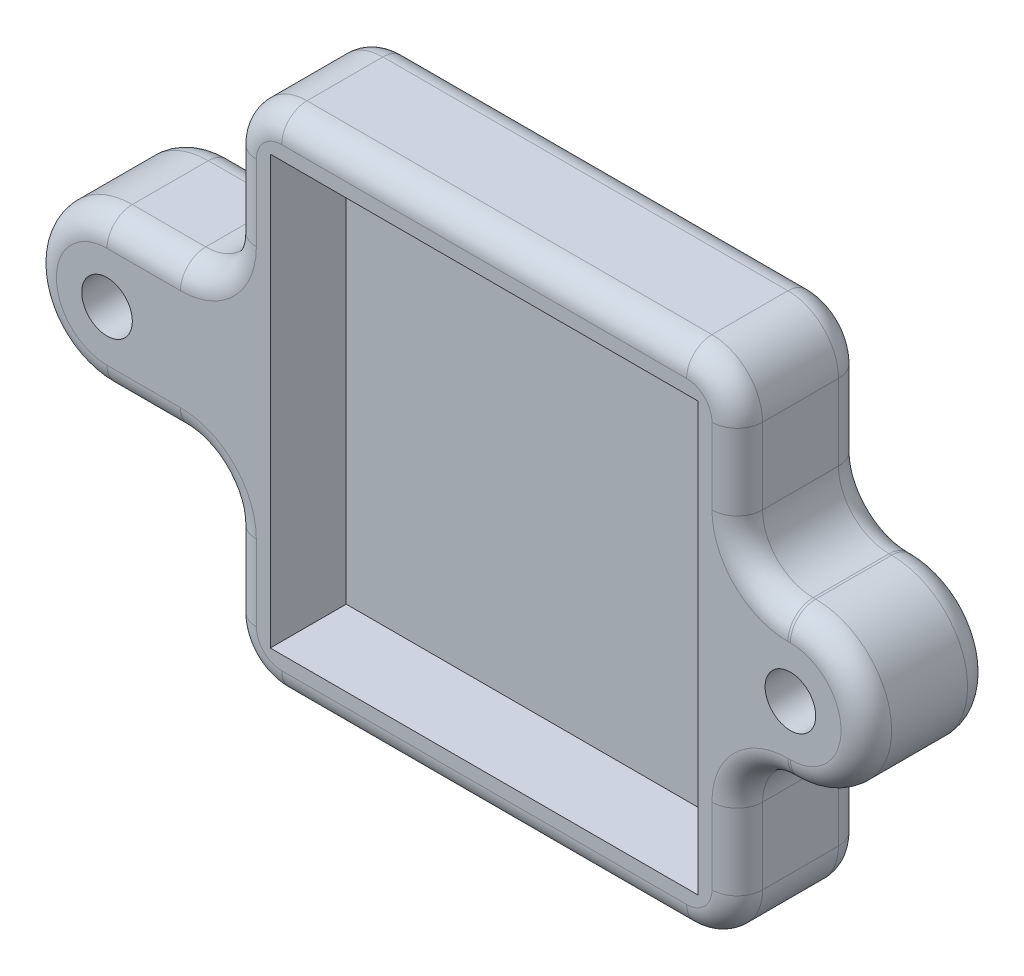
from build123d import *

# Parameters (mm, degrees)
SKETCH1_R           = 1
BOSS_EXTRUDE1_DEPTH = 5
SKETCH2_W           = 16.9
SKETCH2_H           = 16.9
CUT_EXTRUDE1_DEPTH  = 3
FILLET1_R           = 2
FILLET2_R           = 1


with BuildPart() as part:
    # Sketch1 → Boss-Extrude1 (new body)
    with BuildSketch(Plane.XY):
        with BuildLine():
            Line((-12, 3), (-7.1, 3))
            Line((-7.1, 3), (-7.1, 10))
            Line((-7.1, 10), (12.9, 10))
            Line((12.9, 10), (12.9, 3))
            Line((12.9, 3), (15, 3))
            ThreePointArc((15, 3), (18, 0), (15, -3))
            Line((15, -3), (12.9, -3))
            Line((12.9, -3), (12.9, -10))
            Line((12.9, -10), (-7.1, -10))
            Line((-7.1, -10), (-7.1, -3))
            Line((-7.1, -3), (-12, -3))
            ThreePointArc((-12, -3), (-15, 0), (-12, 3))
        make_face()
        with Locations((-12, 0)):
            Circle(SKETCH1_R, mode=Mode.SUBTRACT)
        with Locations((15, 0)):
            Circle(SKETCH1_R, mode=Mode.SUBTRACT)
    extrude(amount=BOSS_EXTRUDE1_DEPTH)

    # Sketch2 → Cut-Extrude1 (cut)
    with BuildSketch(Plane.XY.offset(5)):
        with Locations((2.9, 0)):
            Rectangle(SKETCH2_W, SKETCH2_H)
    extrude(amount=-CUT_EXTRUDE1_DEPTH, mode=Mode.SUBTRACT)

    # Fillet1
    fillet1_edges = [part.edges().sort_by_distance(p)[0] for p in [
        (-7.1, 10, 2.5),
        (12.9, 10, 2.5),
        (12.9, 3, 2.5),
        (12.9, -3, 2.5),
        (12.9, -10, 2.5),
        (-7.1, -10, 2.5),
        (-7.1, -3, 2.5),
        (-7.1, 3, 2.5),
    ]]
    fillet(fillet1_edges, radius=FILLET1_R)

    # Fillet2
    fillet2_edges = [part.edges().sort_by_distance(p)[0] for p in [
        (-15, 0, 5),
        (14.95, 3, 0),
        (18, 0, 0),
        (-10.55, -3, 5),
        (-10.55, -3, 0),
        (-15, 0, 0),
        (18, 0, 5),
        (14.95, 3, 5),
        (12.9, -6.5, 0),
        (12.9, -6.5, 5),
        (-7.1, 6.5, 0),
        (2.9, 10, 0),
        (12.9, 6.5, 0),
        (14.95, -3, 0),
        (2.9, -10, 0),
        (-7.1, -6.5, 0),
        (-10.55, 3, 0),
        (12.314213562, 9.414213562, 0),
        (-6.514213562, 9.414213562, 0),
        (-6.514213562, -9.414213562, 0),
        (12.314213562, -9.414213562, 0),
        (2.9, -10, 5),
        (-7.1, 6.5, 5),
        (-10.55, 3, 5),
        (-7.1, -6.5, 5),
        (14.95, -3, 5),
        (12.9, 6.5, 5),
        (2.9, 10, 5),
        (12.314213562, 9.414213562, 5),
        (-6.514213562, 9.414213562, 5),
        (-6.514213562, -9.414213562, 5),
        (12.314213562, -9.414213562, 5),
        (-7.685786438, -3.585786438, 0),
        (-7.685786438, -3.585786438, 5),
        (-7.685786438, 3.585786438, 0),
        (-7.685786438, 3.585786438, 5),
        (13.485786438, 3.585786438, 0),
        (13.485786438, 3.585786438, 5),
        (13.485786438, -3.585786438, 0),
        (13.485786438, -3.585786438, 5),
    ]]
    fillet(fillet2_edges, radius=FILLET2_R)


solid = part.part
